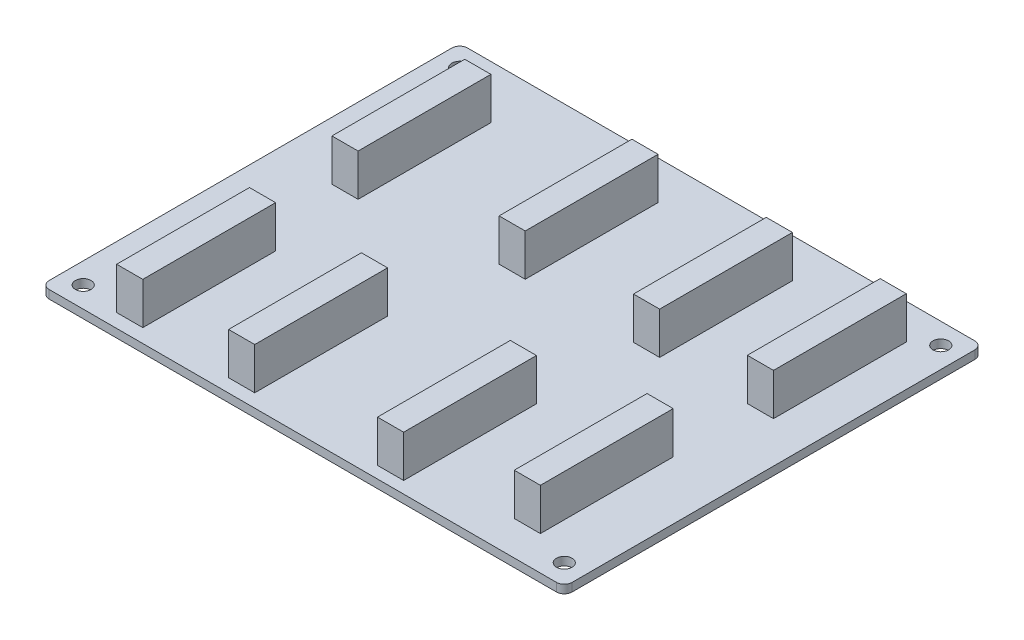
from build123d import *

# Parameters (mm, degrees)
SKETCH1_R           = 1.5
BOSS_EXTRUDE1_DEPTH = 1.6
SKETCH2_W           = 5
SKETCH2_H           = 25.4
BOSS_EXTRUDE2_DEPTH = 8


with BuildPart() as part:
    # Sketch1 → Boss-Extrude1 (new body)
    with BuildSketch(Plane(origin=(0, 0, 0), x_dir=(1, 0, 0), z_dir=(0, 1, 0))):
        with BuildLine():
            Line((1.5, 0), (98.5, 0))
            ThreePointArc((98.5, 0), (99.560660172, 0.439339828), (100, 1.5))
            Line((100, 1.5), (100, 78.5))
            ThreePointArc((100, 78.5), (99.560660172, 79.560660172), (98.5, 80))
            Line((98.5, 80), (1.5, 80))
            ThreePointArc((1.5, 80), (0.439339828, 79.560660172), (0, 78.5))
            Line((0, 78.5), (0, 1.5))
            ThreePointArc((0, 1.5), (0.439339828, 0.439339828), (1.5, 0))
        make_face()
        with Locations(Location((4, 4, 0), (0, 0, 270))):
            Circle(SKETCH1_R, mode=Mode.SUBTRACT)
        with Locations(Location((96, 76, 0), (0, 0, 270))):
            Circle(SKETCH1_R, mode=Mode.SUBTRACT)
        with Locations(Location((96, 4, 0), (0, 0, 270))):
            Circle(SKETCH1_R, mode=Mode.SUBTRACT)
        with Locations(Location((4, 76, 0), (0, 0, 270))):
            Circle(SKETCH1_R, mode=Mode.SUBTRACT)
    extrude(amount=BOSS_EXTRUDE1_DEPTH)

    # Sketch2 → Boss-Extrude2 (add)
    with BuildSketch(Plane(origin=(0, 1.6, 0), x_dir=(1, 0, 0), z_dir=(0, 1, 0))):
        with Locations((14.261833114, 15.332116758)):
            Rectangle(SKETCH2_W, SKETCH2_H)
        with Locations((13.597516255, 57.170048516)):
            Rectangle(SKETCH2_W, SKETCH2_H)
        with Locations((89.647028889, 60.563234223)):
            Rectangle(SKETCH2_W, SKETCH2_H)
        with Locations((86.389643886, 19.240978761)):
            Rectangle(SKETCH2_W, SKETCH2_H)
        with Locations((42.820913135, 59.911757222)):
            Rectangle(SKETCH2_W, SKETCH2_H)
        with Locations((68.613628586, 59.818689079)):
            Rectangle(SKETCH2_W, SKETCH2_H)
        with Locations((35.760574132, 15.239048615)):
            Rectangle(SKETCH2_W, SKETCH2_H)
        with Locations((64.518630297, 14.959844186)):
            Rectangle(SKETCH2_W, SKETCH2_H)
    extrude(amount=BOSS_EXTRUDE2_DEPTH)


solid = part.part
